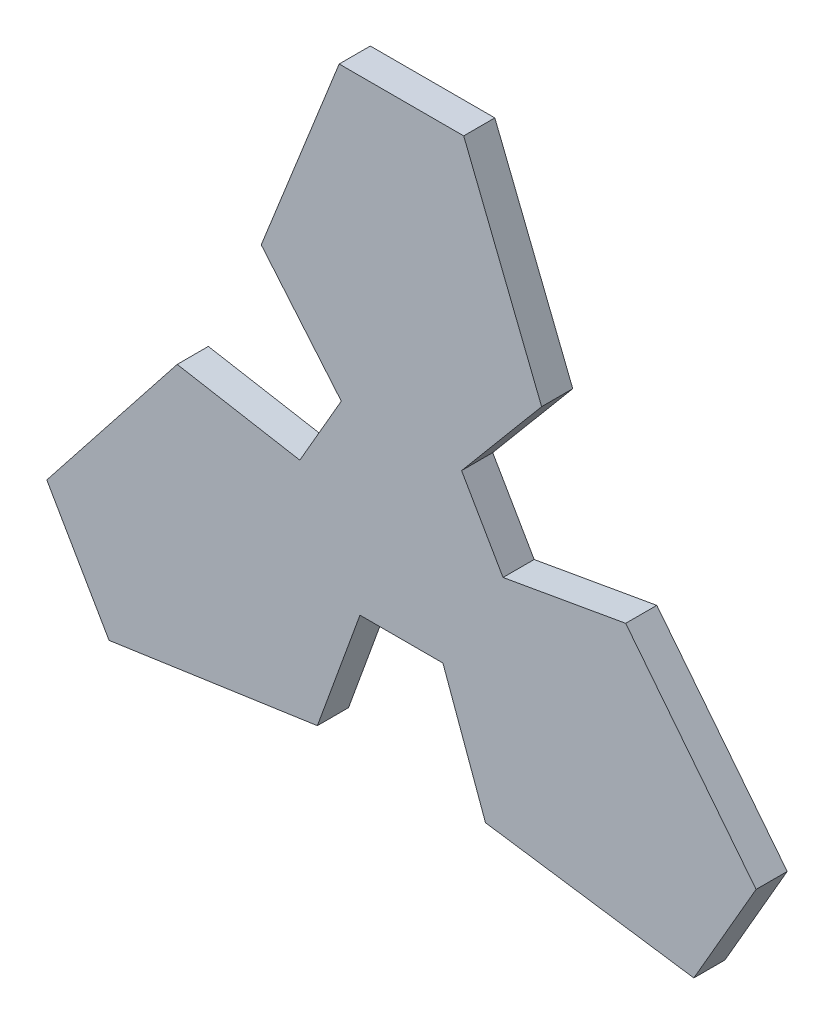
from build123d import *

# Parameters (mm, degrees)
BOSS_EXTRUDE1_DEPTH = 5


with BuildPart() as part:
    # Sketch1 → Boss-Extrude1 (new body)
    with BuildSketch(Plane.XY):
        Polygon((-22.516006232, 28.588838055), (-10, 60), (10, 60), (22.516006232, 28.588838055), (9.660254038, 13.267949192), (12.990381057, 7.5), (16.320508076, 1.732050808), (36.016663136, 5.205014361), (56.961524227, -21.339745962), (46.961524227, -38.660254038), (13.500656904, -33.793852416), (6.660254038, -15), (0, -15), (-6.660254038, -15), (-13.500656904, -33.793852416), (-46.961524227, -38.660254038), (-56.961524227, -21.339745962), (-36.016663136, 5.205014361), (-16.320508076, 1.732050808), (-12.990381057, 7.5), (-9.660254038, 13.267949192), align=None)
    extrude(amount=BOSS_EXTRUDE1_DEPTH)


solid = part.part
